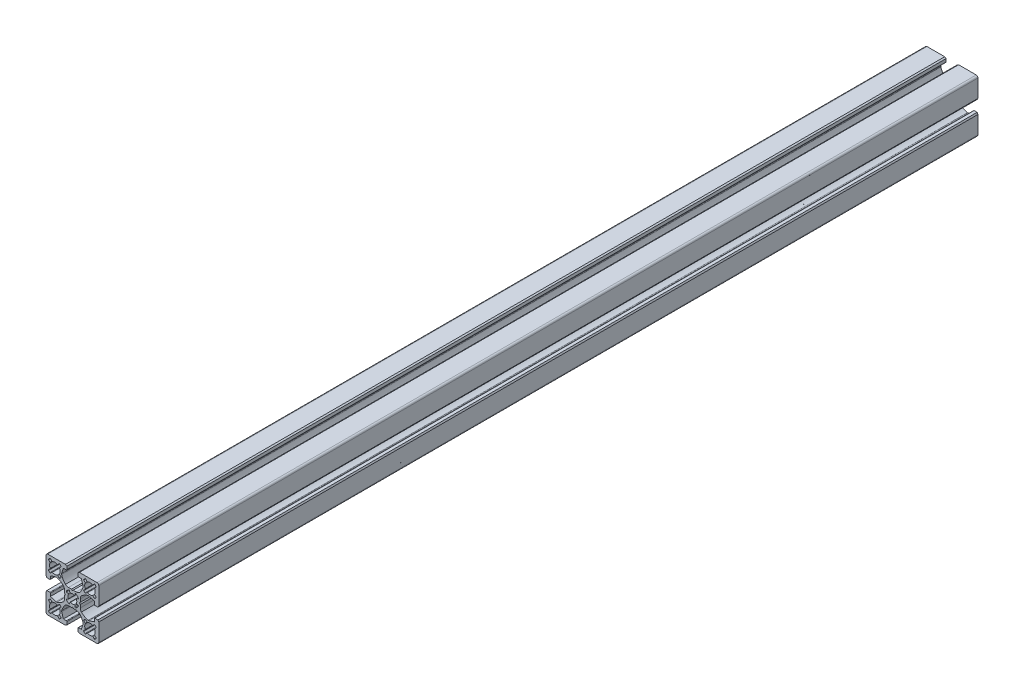
from build123d import *

# Parameters (mm, degrees)
EXTRUDE_1_DEPTH = 500


with BuildPart() as part:
    # Model → 보스-돌출1 (new body)
    with BuildSketch(Plane.XY):
        with BuildLine():
            Line((459.574175407, 182.783831091), (458.774175407, 183.283831091))
            Line((458.774175407, 183.283831091), (458.774175407, 184.983831091))
            ThreePointArc((458.774175407, 184.983831091), (458.862043373, 185.195963125), (459.074175407, 185.283831091))
            Line((459.074175407, 185.283831091), (460.724175407, 185.283831091))
            Line((460.724175407, 185.283831091), (461.711783237, 188.335604532))
            ThreePointArc((461.711783237, 188.335604532), (461.759141443, 188.594081667), (461.737530794, 188.855971354))
            ThreePointArc((461.737530794, 188.855971354), (460.898837663, 190.893750972), (459.628188183, 192.694140329))
            ThreePointArc((459.628188183, 192.694140329), (458.78251429, 193.132596412), (457.842016473, 193.283831091))
            Line((457.842016473, 193.283831091), (456.124175407, 193.283831091))
            Line((456.124175407, 193.283831091), (455.624175407, 193.783831091))
            Line((455.624175407, 193.783831091), (455.124175407, 193.283831091))
            Line((455.124175407, 193.283831091), (453.406334341, 193.283831091))
            ThreePointArc((453.406334341, 193.283831091), (452.465836525, 193.132596412), (451.620162632, 192.694140329))
            ThreePointArc((451.620162632, 192.694140329), (450.349513151, 190.893750972), (449.510820021, 188.855971354))
            ThreePointArc((449.510820021, 188.855971354), (449.489209372, 188.594081667), (449.536567578, 188.335604532))
            Line((449.536567578, 188.335604532), (450.524175407, 185.283831091))
            Line((450.524175407, 185.283831091), (452.174175407, 185.283831091))
            ThreePointArc((452.174175407, 185.283831091), (452.386307442, 185.195963125), (452.474175407, 184.983831091))
            Line((452.474175407, 184.983831091), (452.474175407, 183.283831091))
            Line((452.474175407, 183.283831091), (451.674175407, 182.783831091))
            Line((451.674175407, 182.783831091), (441.624175407, 182.783831091))
            ThreePointArc((441.624175407, 182.783831091), (440.917068626, 183.076724309), (440.624175407, 183.783831091))
            Line((440.624175407, 183.783831091), (440.624175407, 193.833831091))
            Line((440.624175407, 193.833831091), (441.124175407, 194.633831091))
            Line((441.124175407, 194.633831091), (442.824175407, 194.633831091))
            ThreePointArc((442.824175407, 194.633831091), (443.036307442, 194.545963125), (443.124175407, 194.333831091))
            Line((443.124175407, 194.333831091), (443.124175407, 192.683831091))
            Line((443.124175407, 192.683831091), (446.175948849, 191.696223261))
            ThreePointArc((446.175948849, 191.696223261), (446.434425983, 191.648865055), (446.696315671, 191.670475704))
            ThreePointArc((446.696315671, 191.670475704), (448.734095289, 192.509168835), (450.534484646, 193.779818315))
            ThreePointArc((450.534484646, 193.779818315), (450.972940729, 194.625492208), (451.124175407, 195.565990025))
            Line((451.124175407, 195.565990025), (451.124175407, 197.283831091))
            Line((451.124175407, 197.283831091), (451.624175407, 197.783831091))
            Line((451.624175407, 197.783831091), (451.124175407, 198.283831091))
            Line((451.124175407, 198.283831091), (451.124175407, 200.001672157))
            ThreePointArc((451.124175407, 200.001672157), (450.972940729, 200.942169973), (450.534484646, 201.787843866))
            ThreePointArc((450.534484646, 201.787843866), (448.734095289, 203.058493347), (446.696315671, 203.897186477))
            ThreePointArc((446.696315671, 203.897186477), (446.434425983, 203.918797126), (446.175948849, 203.87143892))
            Line((446.175948849, 203.87143892), (443.124175407, 202.883831091))
            Line((443.124175407, 202.883831091), (443.124175407, 201.233831091))
            ThreePointArc((443.124175407, 201.233831091), (443.036307442, 201.021699056), (442.824175407, 200.933831091))
            Line((442.824175407, 200.933831091), (441.124175407, 200.933831091))
            Line((441.124175407, 200.933831091), (440.624175407, 201.733831091))
            Line((440.624175407, 201.733831091), (440.624175407, 211.783831091))
            ThreePointArc((440.624175407, 211.783831091), (440.917068626, 212.490937872), (441.624175407, 212.783831091))
            Line((441.624175407, 212.783831091), (451.674175407, 212.783831091))
            Line((451.674175407, 212.783831091), (452.474175407, 212.283831091))
            Line((452.474175407, 212.283831091), (452.474175407, 210.583831091))
            ThreePointArc((452.474175407, 210.583831091), (452.386307442, 210.371699056), (452.174175407, 210.283831091))
            Line((452.174175407, 210.283831091), (450.524175407, 210.283831091))
            Line((450.524175407, 210.283831091), (449.536567578, 207.232057649))
            ThreePointArc((449.536567578, 207.232057649), (449.489209372, 206.973580515), (449.510820021, 206.711690827))
            ThreePointArc((449.510820021, 206.711690827), (450.349513151, 204.673911209), (451.620162632, 202.873521852))
            ThreePointArc((451.620162632, 202.873521852), (452.465836525, 202.435065769), (453.406334341, 202.283831091))
            Line((453.406334341, 202.283831091), (455.124175407, 202.283831091))
            Line((455.124175407, 202.283831091), (455.624175407, 201.783831091))
            Line((455.624175407, 201.783831091), (456.124175407, 202.283831091))
            Line((456.124175407, 202.283831091), (457.842016473, 202.283831091))
            ThreePointArc((457.842016473, 202.283831091), (458.78251429, 202.435065769), (459.628188183, 202.873521852))
            ThreePointArc((459.628188183, 202.873521852), (460.898837663, 204.673911209), (461.737530794, 206.711690827))
            ThreePointArc((461.737530794, 206.711690827), (461.759141443, 206.973580515), (461.711783237, 207.232057649))
            Line((461.711783237, 207.232057649), (460.724175407, 210.283831091))
            Line((460.724175407, 210.283831091), (459.074175407, 210.283831091))
            ThreePointArc((459.074175407, 210.283831091), (458.862043373, 210.371699056), (458.774175407, 210.583831091))
            Line((458.774175407, 210.583831091), (458.774175407, 212.283831091))
            Line((458.774175407, 212.283831091), (459.574175407, 212.783831091))
            Line((459.574175407, 212.783831091), (469.624175407, 212.783831091))
            ThreePointArc((469.624175407, 212.783831091), (470.331282189, 212.490937872), (470.624175407, 211.783831091))
            Line((470.624175407, 211.783831091), (470.624175407, 201.733831091))
            Line((470.624175407, 201.733831091), (470.124175407, 200.933831091))
            Line((470.124175407, 200.933831091), (468.424175407, 200.933831091))
            ThreePointArc((468.424175407, 200.933831091), (468.212043373, 201.021699056), (468.124175407, 201.233831091))
            Line((468.124175407, 201.233831091), (468.124175407, 202.883831091))
            Line((468.124175407, 202.883831091), (465.072401966, 203.87143892))
            ThreePointArc((465.072401966, 203.87143892), (464.813924831, 203.918797126), (464.552035144, 203.897186477))
            ThreePointArc((464.552035144, 203.897186477), (462.514255526, 203.058493347), (460.713866169, 201.787843866))
            ThreePointArc((460.713866169, 201.787843866), (460.275410086, 200.942169973), (460.124175407, 200.001672157))
            Line((460.124175407, 200.001672157), (460.124175407, 198.283831091))
            Line((460.124175407, 198.283831091), (459.624175407, 197.783831091))
            Line((459.624175407, 197.783831091), (460.124175407, 197.283831091))
            Line((460.124175407, 197.283831091), (460.124175407, 195.565990025))
            ThreePointArc((460.124175407, 195.565990025), (460.275410086, 194.625492208), (460.713866169, 193.779818315))
            ThreePointArc((460.713866169, 193.779818315), (462.514255526, 192.509168835), (464.552035144, 191.670475704))
            ThreePointArc((464.552035144, 191.670475704), (464.813924831, 191.648865055), (465.072401966, 191.696223261))
            Line((465.072401966, 191.696223261), (468.124175407, 192.683831091))
            Line((468.124175407, 192.683831091), (468.124175407, 194.333831091))
            ThreePointArc((468.124175407, 194.333831091), (468.212043373, 194.545963125), (468.424175407, 194.633831091))
            Line((468.424175407, 194.633831091), (470.124175407, 194.633831091))
            Line((470.124175407, 194.633831091), (470.624175407, 193.833831091))
            Line((470.624175407, 193.833831091), (470.624175407, 183.783831091))
            ThreePointArc((470.624175407, 183.783831091), (470.331282189, 183.076724309), (469.624175407, 182.783831091))
            Line((469.624175407, 182.783831091), (459.574175407, 182.783831091))
        make_face()
        with BuildLine():
            Line((462.879323242, 206.101978996), (462.138752469, 205.361408224))
            ThreePointArc((462.138752469, 205.361408224), (462.051316542, 205.165370796), (462.117245146, 204.961093696))
            ThreePointArc((462.117245146, 204.961093696), (462.439854993, 204.601850575), (462.799098114, 204.279240729))
            ThreePointArc((462.799098114, 204.279240729), (463.003375214, 204.213312125), (463.199412641, 204.300748052))
            Line((463.199412641, 204.300748052), (463.939983413, 205.041318824))
            ThreePointArc((463.939983413, 205.041318824), (464.103755722, 205.125263363), (464.285726362, 205.097790817))
            ThreePointArc((464.285726362, 205.097790817), (465.621835508, 204.783831091), (466.957944654, 205.097790817))
            ThreePointArc((466.957944654, 205.097790817), (467.139915294, 205.125263363), (467.303687603, 205.041318824))
            Line((467.303687603, 205.041318824), (468.044258375, 204.300748052))
            ThreePointArc((468.044258375, 204.300748052), (468.240295802, 204.213312125), (468.444572902, 204.279240729))
            ThreePointArc((468.444572902, 204.279240729), (468.803816023, 204.601850575), (469.12642587, 204.961093696))
            ThreePointArc((469.12642587, 204.961093696), (469.192354474, 205.165370796), (469.104918547, 205.361408224))
            Line((469.104918547, 205.361408224), (468.364347775, 206.101978996))
            ThreePointArc((468.364347775, 206.101978996), (468.280403236, 206.265751305), (468.307875782, 206.447721945))
            ThreePointArc((468.307875782, 206.447721945), (468.621835508, 207.783831091), (468.307875782, 209.119940236))
            ThreePointArc((468.307875782, 209.119940236), (468.280403236, 209.301910877), (468.364347774, 209.465683185))
            Line((468.364347774, 209.465683185), (469.104918547, 210.206253957))
            ThreePointArc((469.104918547, 210.206253957), (469.192354474, 210.402291385), (469.12642587, 210.606568485))
            ThreePointArc((469.12642587, 210.606568485), (468.803816023, 210.965811606), (468.444572902, 211.288421452))
            ThreePointArc((468.444572902, 211.288421452), (468.240295802, 211.354350057), (468.044258375, 211.266914129))
            Line((468.044258375, 211.266914129), (467.303687603, 210.526343357))
            ThreePointArc((467.303687603, 210.526343357), (467.139915294, 210.442398819), (466.957944654, 210.469871364))
            ThreePointArc((466.957944654, 210.469871364), (465.621835508, 210.783831091), (464.285726362, 210.469871364))
            ThreePointArc((464.285726362, 210.469871364), (464.103755722, 210.442398819), (463.939983413, 210.526343357))
            Line((463.939983413, 210.526343357), (463.199412641, 211.266914129))
            ThreePointArc((463.199412641, 211.266914129), (463.003375214, 211.354350057), (462.799098114, 211.288421452))
            ThreePointArc((462.799098114, 211.288421452), (462.439854993, 210.965811606), (462.117245146, 210.606568485))
            ThreePointArc((462.117245146, 210.606568485), (462.051316542, 210.402291385), (462.138752469, 210.206253957))
            Line((462.138752469, 210.206253957), (462.879323242, 209.465683185))
            ThreePointArc((462.879323242, 209.465683185), (462.96326778, 209.301910877), (462.935795235, 209.119940236))
            ThreePointArc((462.935795235, 209.119940236), (462.621835508, 207.783831091), (462.935795235, 206.447721945))
            ThreePointArc((462.935795235, 206.447721945), (462.96326778, 206.265751305), (462.879323242, 206.101978996))
        make_face(mode=Mode.SUBTRACT)
        with BuildLine():
            Line((462.878674407, 189.465117129), (462.138161401, 190.205745663))
            ThreePointArc((462.138161401, 190.205745663), (462.050740765, 190.40178991), (462.116685302, 190.606061867))
            ThreePointArc((462.116685302, 190.606061867), (462.439323169, 190.965279823), (462.798591452, 191.287861648))
            ThreePointArc((462.798591452, 191.287861648), (463.002873694, 191.353774318), (463.198904301, 191.2663231))
            Line((463.198904301, 191.2663231), (463.939417306, 190.525694566))
            ThreePointArc((463.939417306, 190.525694566), (464.103183067, 190.441737254), (464.285155849, 190.469195606))
            ThreePointArc((464.285155849, 190.469195606), (465.62128948, 190.783051115), (466.957374133, 190.468987173))
            ThreePointArc((466.957374133, 190.468987173), (467.13934263, 190.441500434), (467.303121485, 190.525432198))
            Line((467.303121485, 190.525432198), (468.04375002, 191.265945204))
            ThreePointArc((468.04375002, 191.265945204), (468.239794266, 191.35336584), (468.444066223, 191.287421303))
            ThreePointArc((468.444066223, 191.287421303), (468.80328418, 190.964783436), (469.125866004, 190.605515153))
            ThreePointArc((469.125866004, 190.605515153), (469.191778675, 190.401232911), (469.104327457, 190.205202304))
            Line((469.104327457, 190.205202304), (468.363698923, 189.464689299))
            ThreePointArc((468.363698923, 189.464689299), (468.27974161, 189.300923538), (468.307199962, 189.118950756))
            ThreePointArc((468.307199962, 189.118950756), (468.621055472, 187.782817125), (468.30699153, 186.446732472))
            ThreePointArc((468.30699153, 186.446732472), (468.279504791, 186.264763975), (468.363436555, 186.100985119))
            Line((468.363436555, 186.100985119), (469.103949561, 185.360356585))
            ThreePointArc((469.103949561, 185.360356585), (469.191370197, 185.164312338), (469.125425659, 184.960040382))
            ThreePointArc((469.125425659, 184.960040382), (468.802787793, 184.600822425), (468.443519509, 184.2782406))
            ThreePointArc((468.443519509, 184.2782406), (468.239237268, 184.21232793), (468.043206661, 184.299779148))
            Line((468.043206661, 184.299779148), (467.302693655, 185.040407682))
            ThreePointArc((467.302693655, 185.040407682), (467.138927895, 185.124364994), (466.956955112, 185.096906643))
            ThreePointArc((466.956955112, 185.096906643), (465.620821482, 184.783051133), (464.284736829, 185.097115075))
            ThreePointArc((464.284736829, 185.097115075), (464.102768332, 185.124601814), (463.938989476, 185.04067005))
            Line((463.938989476, 185.04067005), (463.198360942, 184.300157044))
            ThreePointArc((463.198360942, 184.300157044), (463.002316695, 184.212736408), (462.798044738, 184.278680946))
            ThreePointArc((462.798044738, 184.278680946), (462.438826782, 184.601318812), (462.116244957, 184.960587096))
            ThreePointArc((462.116244957, 184.960587096), (462.050332287, 185.164869337), (462.137783504, 185.360899944))
            Line((462.137783504, 185.360899944), (462.878412039, 186.10141295))
            ThreePointArc((462.878412039, 186.10141295), (462.962369351, 186.26517871), (462.934910999, 186.447151493))
            ThreePointArc((462.934910999, 186.447151493), (462.62105549, 187.783285123), (462.935119432, 189.119369776))
            ThreePointArc((462.935119432, 189.119369776), (462.962606171, 189.301338273), (462.878674407, 189.465117129))
        make_face(mode=Mode.SUBTRACT)
        with BuildLine():
            Line((448.367336509, 189.465117129), (449.107849514, 190.205745663))
            ThreePointArc((449.107849514, 190.205745663), (449.195270151, 190.40178991), (449.129325613, 190.606061867))
            ThreePointArc((449.129325613, 190.606061867), (448.806687747, 190.965279823), (448.447419463, 191.287861648))
            ThreePointArc((448.447419463, 191.287861648), (448.243137222, 191.353774318), (448.047106615, 191.2663231))
            Line((448.047106615, 191.2663231), (447.306593609, 190.525694566))
            ThreePointArc((447.306593609, 190.525694566), (447.142827848, 190.441737254), (446.960855066, 190.469195606))
            ThreePointArc((446.960855066, 190.469195606), (445.624721436, 190.783051115), (444.288636783, 190.468987173))
            ThreePointArc((444.288636783, 190.468987173), (444.106668286, 190.441500434), (443.94288943, 190.525432198))
            Line((443.94288943, 190.525432198), (443.202260896, 191.265945204))
            ThreePointArc((443.202260896, 191.265945204), (443.006216649, 191.35336584), (442.801944692, 191.287421303))
            ThreePointArc((442.801944692, 191.287421303), (442.442726735, 190.964783436), (442.120144911, 190.605515153))
            ThreePointArc((442.120144911, 190.605515153), (442.054232241, 190.401232911), (442.141683458, 190.205202304))
            Line((442.141683458, 190.205202304), (442.882311993, 189.464689299))
            ThreePointArc((442.882311993, 189.464689299), (442.966269305, 189.300923538), (442.938810953, 189.118950756))
            ThreePointArc((442.938810953, 189.118950756), (442.624955444, 187.782817125), (442.939019385, 186.446732472))
            ThreePointArc((442.939019385, 186.446732472), (442.966506124, 186.264763975), (442.88257436, 186.100985119))
            Line((442.88257436, 186.100985119), (442.142061355, 185.360356585))
            ThreePointArc((442.142061355, 185.360356585), (442.054640719, 185.164312338), (442.120585256, 184.960040382))
            ThreePointArc((442.120585256, 184.960040382), (442.443223122, 184.600822425), (442.802491406, 184.2782406))
            ThreePointArc((442.802491406, 184.2782406), (443.006773648, 184.21232793), (443.202804255, 184.299779148))
            Line((443.202804255, 184.299779148), (443.94331726, 185.040407682))
            ThreePointArc((443.94331726, 185.040407682), (444.107083021, 185.124364994), (444.289055803, 185.096906643))
            ThreePointArc((444.289055803, 185.096906643), (445.625189434, 184.783051133), (446.961274087, 185.097115075))
            ThreePointArc((446.961274087, 185.097115075), (447.143242583, 185.124601814), (447.307021439, 185.04067005))
            Line((447.307021439, 185.04067005), (448.047649974, 184.300157044))
            ThreePointArc((448.047649974, 184.300157044), (448.24369422, 184.212736408), (448.447966177, 184.278680946))
            ThreePointArc((448.447966177, 184.278680946), (448.807184134, 184.601318812), (449.129765958, 184.960587096))
            ThreePointArc((449.129765958, 184.960587096), (449.195678629, 185.164869337), (449.108227411, 185.360899944))
            Line((449.108227411, 185.360899944), (448.367598877, 186.10141295))
            ThreePointArc((448.367598877, 186.10141295), (448.283641564, 186.26517871), (448.311099916, 186.447151493))
            ThreePointArc((448.311099916, 186.447151493), (448.624955426, 187.783285123), (448.310891484, 189.119369776))
            ThreePointArc((448.310891484, 189.119369776), (448.283404745, 189.301338273), (448.367336509, 189.465117129))
        make_face(mode=Mode.SUBTRACT)
        with BuildLine():
            Line((457.210300672, 201.021172973), (457.076729929, 200.280239327))
            ThreePointArc((457.076729929, 200.280239327), (456.920864875, 200.06780508), (456.657491136, 200.060288559))
            ThreePointArc((456.657491136, 200.060288559), (455.624175407, 200.283831091), (454.590859679, 200.060288559))
            ThreePointArc((454.590859679, 200.060288559), (454.32748594, 200.06780508), (454.171620886, 200.280239327))
            Line((454.171620886, 200.280239327), (454.038050143, 201.021172973))
            ThreePointArc((454.038050143, 201.021172973), (453.867687152, 201.240722573), (453.590171174, 201.226215416))
            ThreePointArc((453.590171174, 201.226215416), (452.796918232, 200.611088266), (452.181791082, 199.817835324))
            ThreePointArc((452.181791082, 199.817835324), (452.167283925, 199.540319346), (452.386833525, 199.369956355))
            Line((452.386833525, 199.369956355), (453.127767171, 199.236385612))
            ThreePointArc((453.127767171, 199.236385612), (453.340201418, 199.080520558), (453.347717939, 198.817146819))
            ThreePointArc((453.347717939, 198.817146819), (453.124175407, 197.783831091), (453.347717939, 196.750515362))
            ThreePointArc((453.347717939, 196.750515362), (453.340201418, 196.487141623), (453.127767171, 196.331276569))
            Line((453.127767171, 196.331276569), (452.386833525, 196.197705826))
            ThreePointArc((452.386833525, 196.197705826), (452.167283925, 196.027342835), (452.181791082, 195.749826857))
            ThreePointArc((452.181791082, 195.749826857), (452.796918232, 194.956573915), (453.590171174, 194.341446765))
            ThreePointArc((453.590171174, 194.341446765), (453.867687152, 194.326939608), (454.038050143, 194.546489208))
            Line((454.038050143, 194.546489208), (454.171620886, 195.287422854))
            ThreePointArc((454.171620886, 195.287422854), (454.32748594, 195.499857101), (454.590859679, 195.507373622))
            ThreePointArc((454.590859679, 195.507373622), (455.624175407, 195.283831091), (456.657491136, 195.507373622))
            ThreePointArc((456.657491136, 195.507373622), (456.920864875, 195.499857101), (457.076729929, 195.287422854))
            Line((457.076729929, 195.287422854), (457.210300672, 194.546489208))
            ThreePointArc((457.210300672, 194.546489208), (457.380663663, 194.326939608), (457.658179641, 194.341446765))
            ThreePointArc((457.658179641, 194.341446765), (458.451432582, 194.956573915), (459.066559733, 195.749826857))
            ThreePointArc((459.066559733, 195.749826857), (459.08106689, 196.027342835), (458.86151729, 196.197705826))
            Line((458.86151729, 196.197705826), (458.120583644, 196.331276569))
            ThreePointArc((458.120583644, 196.331276569), (457.908149397, 196.487141623), (457.900632876, 196.750515362))
            ThreePointArc((457.900632876, 196.750515362), (458.124175407, 197.783831091), (457.900632876, 198.817146819))
            ThreePointArc((457.900632876, 198.817146819), (457.908149397, 199.080520558), (458.120583644, 199.236385612))
            Line((458.120583644, 199.236385612), (458.86151729, 199.369956355))
            ThreePointArc((458.86151729, 199.369956355), (459.08106689, 199.540319346), (459.066559733, 199.817835324))
            ThreePointArc((459.066559733, 199.817835324), (458.451432582, 200.611088266), (457.658179641, 201.226215416))
            ThreePointArc((457.658179641, 201.226215416), (457.380663663, 201.240722573), (457.210300672, 201.021172973))
        make_face(mode=Mode.SUBTRACT)
        with BuildLine():
            Line((448.366687674, 206.101978996), (449.107258446, 205.361408224))
            ThreePointArc((449.107258446, 205.361408224), (449.194694373, 205.165370796), (449.128765769, 204.961093696))
            ThreePointArc((449.128765769, 204.961093696), (448.806155923, 204.601850575), (448.446912802, 204.279240729))
            ThreePointArc((448.446912802, 204.279240729), (448.242635702, 204.213312125), (448.046598274, 204.300748052))
            Line((448.046598274, 204.300748052), (447.306027502, 205.041318824))
            ThreePointArc((447.306027502, 205.041318824), (447.142255193, 205.125263363), (446.960284553, 205.097790817))
            ThreePointArc((446.960284553, 205.097790817), (445.624175407, 204.783831091), (444.288066262, 205.097790817))
            ThreePointArc((444.288066262, 205.097790817), (444.106095621, 205.125263363), (443.942323313, 205.041318824))
            Line((443.942323313, 205.041318824), (443.20175254, 204.300748052))
            ThreePointArc((443.20175254, 204.300748052), (443.005715113, 204.213312125), (442.801438013, 204.279240729))
            ThreePointArc((442.801438013, 204.279240729), (442.442194892, 204.601850575), (442.119585046, 204.961093696))
            ThreePointArc((442.119585046, 204.961093696), (442.053656441, 205.165370796), (442.141092369, 205.361408224))
            Line((442.141092369, 205.361408224), (442.881663141, 206.101978996))
            ThreePointArc((442.881663141, 206.101978996), (442.965607679, 206.265751305), (442.938135134, 206.447721945))
            ThreePointArc((442.938135134, 206.447721945), (442.624175407, 207.783831091), (442.938135134, 209.119940236))
            ThreePointArc((442.938135134, 209.119940236), (442.965607679, 209.301910877), (442.881663141, 209.465683185))
            Line((442.881663141, 209.465683185), (442.141092369, 210.206253957))
            ThreePointArc((442.141092369, 210.206253957), (442.053656441, 210.402291385), (442.119585046, 210.606568485))
            ThreePointArc((442.119585046, 210.606568485), (442.442194892, 210.965811606), (442.801438013, 211.288421452))
            ThreePointArc((442.801438013, 211.288421452), (443.005715113, 211.354350057), (443.20175254, 211.266914129))
            Line((443.20175254, 211.266914129), (443.942323313, 210.526343357))
            ThreePointArc((443.942323313, 210.526343357), (444.106095621, 210.442398819), (444.288066262, 210.469871364))
            ThreePointArc((444.288066262, 210.469871364), (445.624175407, 210.783831091), (446.960284553, 210.469871364))
            ThreePointArc((446.960284553, 210.469871364), (447.142255193, 210.442398819), (447.306027502, 210.526343357))
            Line((447.306027502, 210.526343357), (448.046598274, 211.266914129))
            ThreePointArc((448.046598274, 211.266914129), (448.242635702, 211.354350056), (448.446912802, 211.288421452))
            ThreePointArc((448.446912802, 211.288421452), (448.806155923, 210.965811606), (449.128765769, 210.606568485))
            ThreePointArc((449.128765769, 210.606568485), (449.194694373, 210.402291385), (449.107258446, 210.206253957))
            Line((449.107258446, 210.206253957), (448.366687674, 209.465683185))
            ThreePointArc((448.366687674, 209.465683185), (448.282743135, 209.301910877), (448.310215681, 209.119940236))
            ThreePointArc((448.310215681, 209.119940236), (448.624175407, 207.783831091), (448.310215681, 206.447721945))
            ThreePointArc((448.310215681, 206.447721945), (448.282743135, 206.265751305), (448.366687674, 206.101978996))
        make_face(mode=Mode.SUBTRACT)
    extrude(amount=EXTRUDE_1_DEPTH)


solid = part.part
